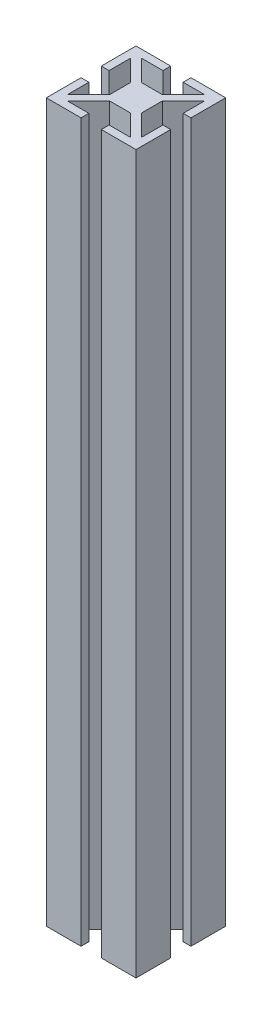
from build123d import *

# Parameters (mm, degrees)
BOSS_EXTRUDE1_DEPTH = 203.2


with BuildPart() as part:
    # Sketch1 → Boss-Extrude1 (new body)
    with BuildSketch(Plane(origin=(11.365010382, 0, 9.846206226), x_dir=(1, 0, 0), z_dir=(0, 1, 0))):
        Polygon((-24.065010382, 22.546206226), (-14.229795365, 22.546206226), (-14.229795365, 20.336406226), (-20.292645817, 20.336406226), (-14.310945817, 14.354706226), (-8.419074947, 14.354706226), (-2.437374947, 20.336406226), (-8.5002254, 20.336406226), (-8.5002254, 22.546206226), (1.334989618, 22.546206226), (1.334989618, 12.710991208), (-0.874810382, 12.710991208), (-0.874810382, 18.773841661), (-6.856510382, 12.792141661), (-6.856510382, 6.900270791), (-0.874810382, 0.918570791), (-0.874810382, 6.981421243), (1.334989618, 6.981421243), (1.334989618, -2.853793774), (-8.5002254, -2.853793774), (-8.5002254, -0.643993774), (-2.437374947, -0.643993774), (-8.419074947, 5.337706226), (-14.310945817, 5.337706226), (-20.292645817, -0.643993774), (-14.229795365, -0.643993774), (-14.229795365, -2.853793774), (-24.065010382, -2.853793774), (-24.065010382, 6.981421243), (-21.855210382, 6.981421243), (-21.855210382, 0.918570791), (-15.873510382, 6.900270791), (-15.873510382, 12.792141661), (-21.855210382, 18.773841661), (-21.855210382, 12.710991208), (-24.065010382, 12.710991208), align=None)
    extrude(amount=BOSS_EXTRUDE1_DEPTH)


solid = part.part
